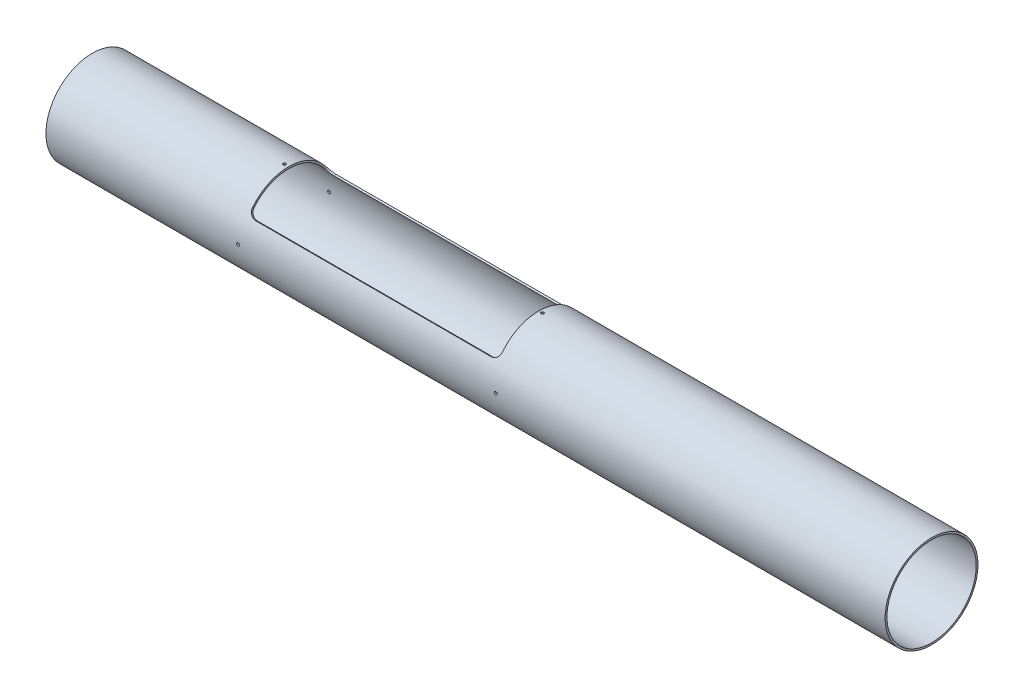
from build123d import *

# Parameters (mm, degrees)
SKETCH1_R               = 65
SKETCH1_R_2             = 62.5
BOSS_EXTRUDE1_DEPTH     = 587.5
CUT_EXTRUDE1_DEPTH      = 37.5
CUT_EXTRUDE1_DEPTH_BACK = 312.5
FILLET1_R               = 10
SKETCH5_R               = 2
CUT_EXTRUDE2_DEPTH      = 100
SKETCH6_R               = 2
CUT_EXTRUDE3_DEPTH      = 135.5


with BuildPart() as part:
    # Sketch1 → Boss-Extrude1 (new, symmetric)
    with BuildSketch(Plane(origin=(0, 0, 0), x_dir=(0, 0, -1), z_dir=(1, 0, 0))):
        Circle(SKETCH1_R)
        Circle(SKETCH1_R_2, mode=Mode.SUBTRACT)
    extrude(amount=BOSS_EXTRUDE1_DEPTH, both=True)

    # Sketch3 → Cut-Extrude1 (cut, two sides: drawn at the far end of the back side and taken through both)
    with BuildSketch(Plane(origin=(0, 0, 0), x_dir=(0, 0, -1), z_dir=(1, 0, 0)).offset(-CUT_EXTRUDE1_DEPTH_BACK)):
        with BuildLine():
            Line((-56.291651246, 32.5), (-54.126587737, 31.25))
            ThreePointArc((-54.126587737, 31.25), (0, 62.5), (54.126587737, 31.25))
            Line((54.126587737, 31.25), (56.291651246, 32.5))
            ThreePointArc((56.291651246, 32.5), (0, 65), (-56.291651246, 32.5))
        make_face()
    extrude(amount=CUT_EXTRUDE1_DEPTH + CUT_EXTRUDE1_DEPTH_BACK, mode=Mode.SUBTRACT)

    # Fillet1
    fillet1_edges = [part.edges().sort_by_distance(p)[0] for p in [
        (-312.5, 31.875, 55.209119491),
        (-312.5, 31.875, -55.209119491),
        (37.5, 31.875, 55.209119491),
        (37.5, 31.875, -55.209119491),
    ]]
    fillet(fillet1_edges, radius=FILLET1_R)

    # Sketch5 → Cut-Extrude2 (cut, symmetric)
    with BuildSketch(Plane(origin=(0, 0, 0), x_dir=(1, 0, 0), z_dir=(0, 1, 0))):
        with Locations(Location((-318.5, 0, 0), (0, 0, 270))):
            Circle(SKETCH5_R)
        with Locations(Location((42.5, 0, 0), (0, 0, 270))):
            Circle(SKETCH5_R)
    extrude(amount=CUT_EXTRUDE2_DEPTH, both=True, mode=Mode.SUBTRACT)

    # Sketch6 → Cut-Extrude3 (cut, symmetric)
    with BuildSketch(Plane.XY):
        with Locations((-318.5, 0)):
            Circle(SKETCH6_R)
        with Locations((42.5, 0)):
            Circle(SKETCH6_R)
    extrude(amount=CUT_EXTRUDE3_DEPTH, both=True, mode=Mode.SUBTRACT)


solid = part.part
